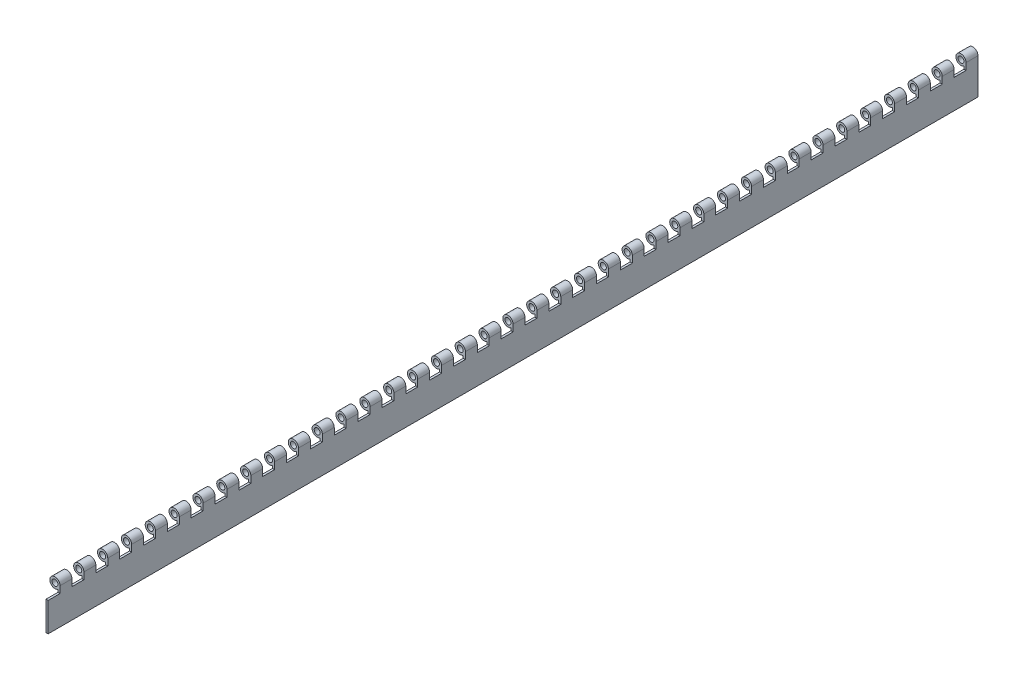
from build123d import *

# Parameters (mm, degrees)
SKETCH1_R           = 3.175
BOSS_EXTRUDE1_DEPTH = 990.6
SKETCH2_W           = 12.7
SKETCH2_H           = 12.7
CUT_EXTRUDE1_DEPTH  = 992.392586256
LPATTERN1_COUNT     = 39
LPATTERN1_PITCH     = 25.4


with BuildPart() as part:
    # Sketch1 → Boss-Extrude1 (new body)
    with BuildSketch(Plane.XY):
        with BuildLine():
            Line((5.461, 0), (5.461, -38.1))
            Line((5.461, -38.1), (3.175, -38.1))
            Line((3.175, -38.1), (3.175, -4.443185344))
            ThreePointArc((3.175, -4.443185344), (-4.855985791, 2.498384078), (5.461, 0))
        make_face()
        Circle(SKETCH1_R, mode=Mode.SUBTRACT)
    extrude(amount=BOSS_EXTRUDE1_DEPTH)

    # Sketch2 → Cut-Extrude1 (cut, through all)
    with BuildSketch(Plane(origin=(5.461, 0, 0), x_dir=(0, 0, -1), z_dir=(1, 0, 0))):
        with Locations((-984.25, -0.889)):
            Rectangle(SKETCH2_W, SKETCH2_H)
    cut_extrude1 = extrude(amount=-CUT_EXTRUDE1_DEPTH, mode=Mode.SUBTRACT)

    # LPattern1: Cut-Extrude1 ×39
    with Locations(*[(0, 0, -i * LPATTERN1_PITCH) for i in range(1, LPATTERN1_COUNT)]):
        add(cut_extrude1, mode=Mode.SUBTRACT)


solid = part.part
